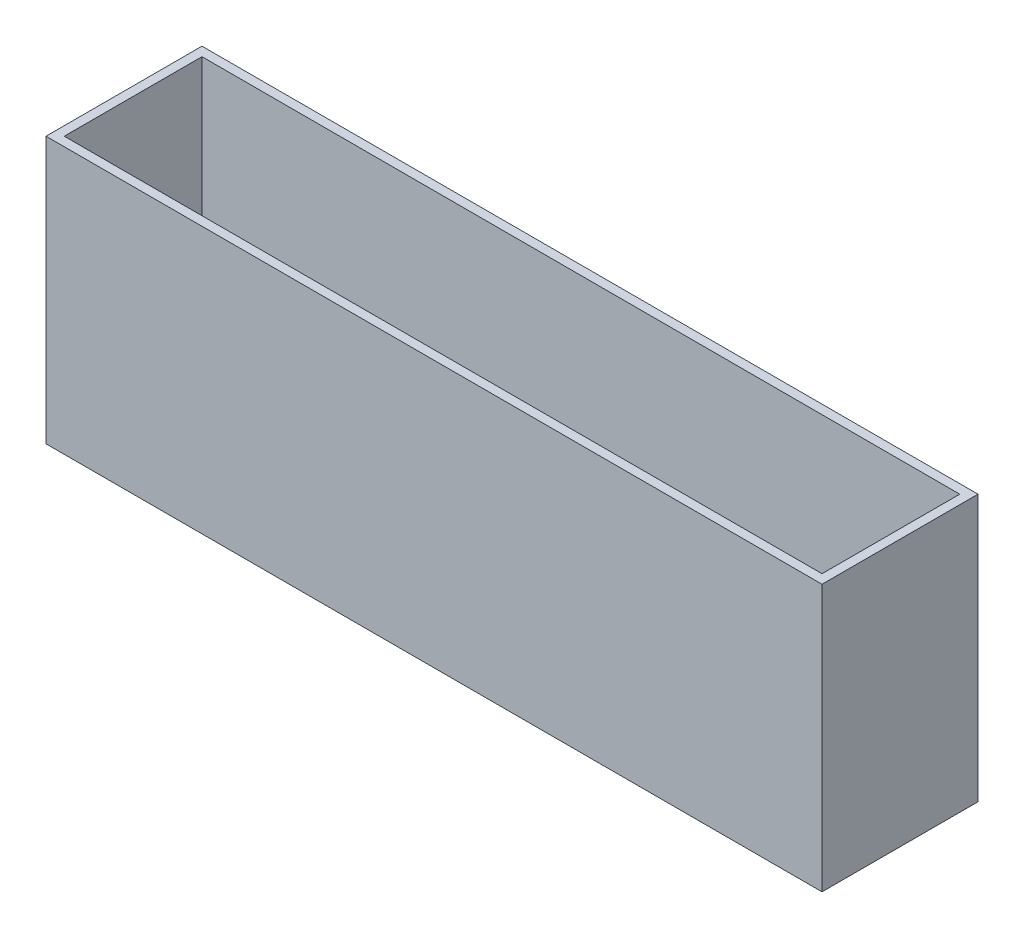
from build123d import *

# Parameters (mm, degrees)
SKETCH1_W           = 255.2634
SKETCH1_H           = 87.63
BOSS_EXTRUDE1_DEPTH = 51.308
SHELL1_T            = -3


with BuildPart() as part:
    # Sketch1 → Boss-Extrude1 (new body)
    with BuildSketch(Plane.XY):
        with Locations((-91.210148042, -8.098763373)):
            Rectangle(SKETCH1_W, SKETCH1_H)
    extrude(amount=BOSS_EXTRUDE1_DEPTH)

    # Shell1
    shell1_openings = [part.faces().sort_by_distance(p)[0] for p in [
        (-91.210148042, 35.716236627, 25.654),
    ]]
    offset(amount=SHELL1_T, openings=shell1_openings, kind=Kind.INTERSECTION)


solid = part.part
